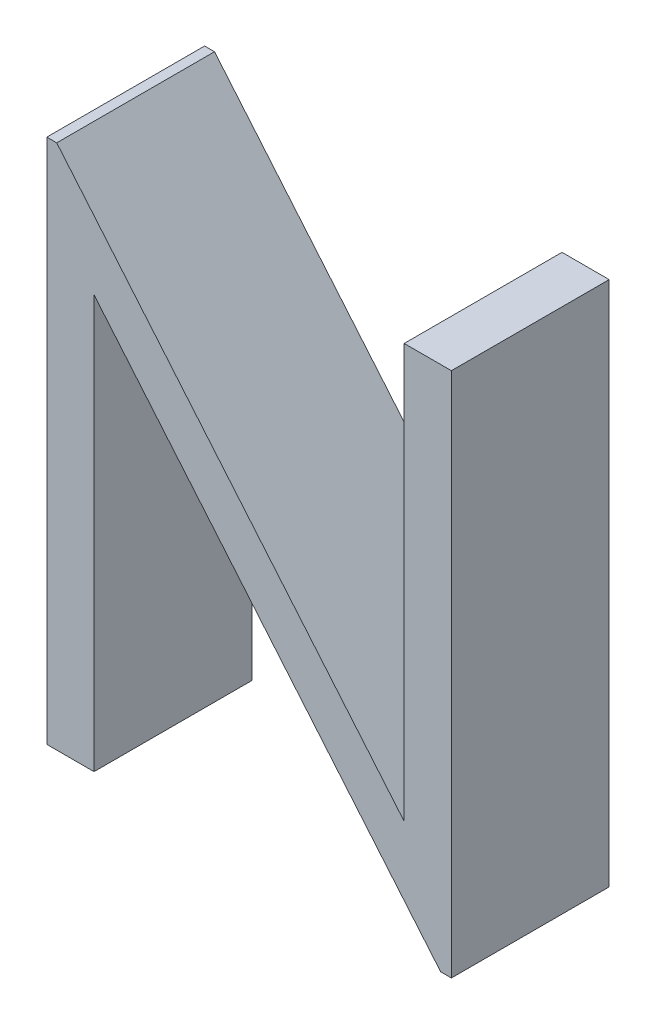
from build123d import *

# Parameters (mm, degrees)
BOSS_EXTRU_1_DEPTH = 1.5


with BuildPart() as part:
    # Esquisse1 → Boss.-Extru.1 (new body)
    with BuildSketch(Plane.XY):
        Polygon((-55.432465326, -22.870119076), (-55.432465326, -17.870119076), (-55.338314685, -17.870119076), (-52.035029428, -21.805415551), (-52.035029428, -17.870119076), (-51.58631148, -17.870119076), (-51.58631148, -22.870119076), (-51.688474941, -22.870119076), (-54.983747377, -18.943837025), (-54.983747377, -22.870119076), align=None)
    extrude(amount=BOSS_EXTRU_1_DEPTH)


solid = part.part
